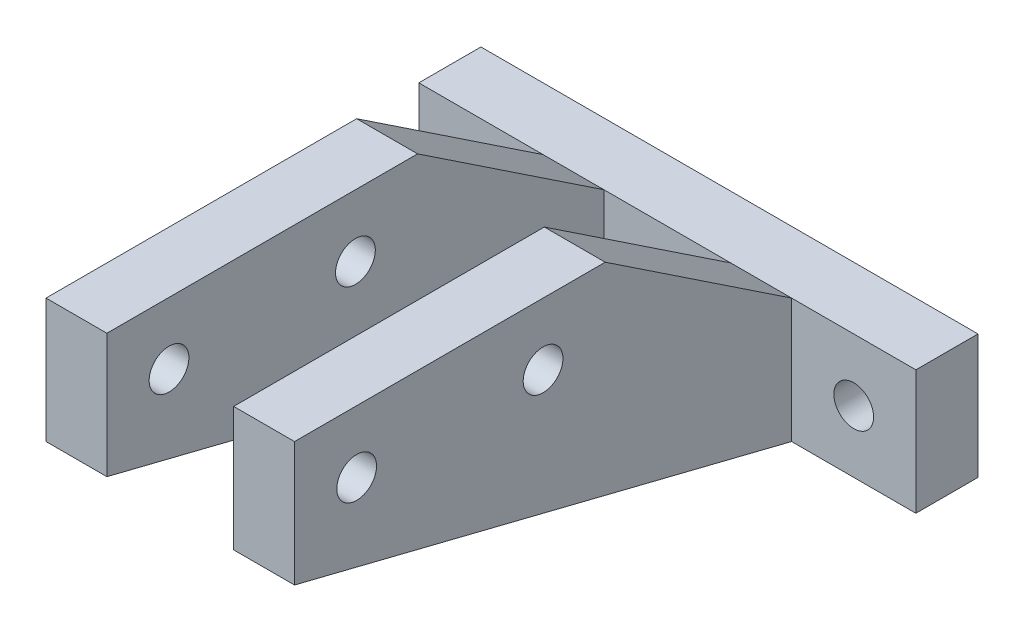
from build123d import *

# Parameters (mm, degrees)
SKETCH1_W           = 40
SKETCH1_H           = 10
BOSS_EXTRUDE1_DEPTH = 5
SKETCH2_W           = 4.9
SKETCH2_H           = 20
BOSS_EXTRUDE2_DEPTH = 40
CUT_EXTRUDE1_REACH  = 58.125
SKETCH3_R           = 1.6
CUT_EXTRUDE2_REACH  = 58.125
CUT_EXTRUDE3_REACH  = 58.125
CUT_EXTRUDE4_REACH  = 53.478
SKETCH6_R           = 1.6
SKETCH7_W           = 10.2
SKETCH7_H           = 3
BOSS_EXTRUDE3_DEPTH = 40
CUT_EXTRUDE5_DEPTH  = 40
SKETCH10_W          = 10.2
SKETCH10_H          = 2
BOSS_EXTRUDE4_DEPTH = 12


with BuildPart() as part:
    # Sketch1 → Boss-Extrude1 (new body)
    with BuildSketch(Plane.XY):
        Rectangle(SKETCH1_W, SKETCH1_H)
    extrude(amount=BOSS_EXTRUDE1_DEPTH)

    # Sketch2 → Boss-Extrude2 (add)
    with BuildSketch(Plane.XY.offset(5)):
        with Locations((7.55, 5)):
            Rectangle(SKETCH2_W, SKETCH2_H)
        with Locations((-7.55, 5)):
            Rectangle(SKETCH2_W, SKETCH2_H)
    extrude(amount=BOSS_EXTRUDE2_DEPTH)

    # Cut-Extrude1: up to this face of the body (flat: up to its plane)
    cut_extrude1_end = Plane(part.part.faces().sort_by_distance((10, 5, 25))[0])
    # Sketch3 → Cut-Extrude1 (cut, up to the picked face)
    with BuildSketch(Plane.ZY.offset(10), mode=Mode.PRIVATE) as cut_extrude1_sk1:
        with Locations((40, 10)):
            Circle(SKETCH3_R)
    cut_extrude1_tool1 = split(extrude(cut_extrude1_sk1.sketch, amount=-CUT_EXTRUDE1_REACH, mode=Mode.PRIVATE), bisect_by=cut_extrude1_end, keep=Keep.BOTH, mode=Mode.PRIVATE)
    # Sketch3 → Cut-Extrude1 (cut, up to the picked face)
    with BuildSketch(Plane.ZY.offset(10), mode=Mode.PRIVATE) as cut_extrude1_sk2:
        with Locations((25, 10)):
            Circle(SKETCH3_R)
    cut_extrude1_tool2 = split(extrude(cut_extrude1_sk2.sketch, amount=-CUT_EXTRUDE1_REACH, mode=Mode.PRIVATE), bisect_by=cut_extrude1_end, keep=Keep.BOTH, mode=Mode.PRIVATE)
    add(cut_extrude1_tool1.solids().sort_by(Axis((-10, 10, 40), (1, 0, 0)))[0], mode=Mode.SUBTRACT)
    add(cut_extrude1_tool2.solids().sort_by(Axis((-10, 10, 25), (1, 0, 0)))[0], mode=Mode.SUBTRACT)

    # Cut-Extrude2: up to this face of the body (flat: up to its plane)
    cut_extrude2_end = Plane(part.part.faces().sort_by_distance((10, 4.897406266, 24.846109398))[0])
    # Sketch4 → Cut-Extrude2 (cut, up to the picked face)
    with BuildSketch(Plane.ZY.offset(10), mode=Mode.PRIVATE) as cut_extrude2_sk1:
        Polygon((5, 5), (20, 15), (5, 15), align=None)
    cut_extrude2_tool1 = split(extrude(cut_extrude2_sk1.sketch, amount=-CUT_EXTRUDE2_REACH, mode=Mode.PRIVATE), bisect_by=cut_extrude2_end, keep=Keep.BOTH, mode=Mode.PRIVATE)
    add(cut_extrude2_tool1.solids().sort_by(Axis((-10, 11.666667, 10), (1, 0, 0)))[0], mode=Mode.SUBTRACT)

    # Cut-Extrude3: up to this face of the body (flat: up to its plane)
    cut_extrude3_end = Plane(part.part.faces().sort_by_distance((10, 4.181249184, 26.416760511))[0])
    # Sketch5 → Cut-Extrude3 (cut, up to the picked face)
    with BuildSketch(Plane.ZY.offset(10), mode=Mode.PRIVATE) as cut_extrude3_sk1:
        Polygon((45, 5), (5, -5), (45, -5), align=None)
    cut_extrude3_tool1 = split(extrude(cut_extrude3_sk1.sketch, amount=-CUT_EXTRUDE3_REACH, mode=Mode.PRIVATE), bisect_by=cut_extrude3_end, keep=Keep.BOTH, mode=Mode.PRIVATE)
    add(cut_extrude3_tool1.solids().sort_by(Axis((-10, -1.666667, 31.666667), (1, 0, 0)))[0], mode=Mode.SUBTRACT)

    # Sketch6 → Cut-Extrude4 (cut, up to next)
    with BuildSketch(Plane(origin=(0, 0, 0), x_dir=(-1, 0, 0), z_dir=(0, 0, -1)), mode=Mode.PRIVATE) as cut_extrude4_sk1:
        with Locations((-15, 0)):
            Circle(SKETCH6_R)
    cut_extrude4_tool1 = extrude(cut_extrude4_sk1.sketch, amount=-CUT_EXTRUDE4_REACH, mode=Mode.PRIVATE) & part.part
    # Sketch6 → Cut-Extrude4 (cut, up to next)
    with BuildSketch(Plane(origin=(0, 0, 0), x_dir=(-1, 0, 0), z_dir=(0, 0, -1)), mode=Mode.PRIVATE) as cut_extrude4_sk2:
        with Locations(Location((15, 0, 0), (0, 0, 180))):
            Circle(SKETCH6_R)
    cut_extrude4_tool2 = extrude(cut_extrude4_sk2.sketch, amount=-CUT_EXTRUDE4_REACH, mode=Mode.PRIVATE) & part.part
    add(cut_extrude4_tool1.solids().sort_by_distance((15, 0, 0))[0], mode=Mode.SUBTRACT)
    add(cut_extrude4_tool2.solids().sort_by_distance((-15, 0, 0))[0], mode=Mode.SUBTRACT)

    # Sketch7 → Boss-Extrude3 (add)
    with BuildSketch(Plane.XY.offset(5)):
        with Locations((0, -3.5)):
            Rectangle(SKETCH7_W, SKETCH7_H)
    extrude(amount=BOSS_EXTRUDE3_DEPTH)

    # Sketch8 → Cut-Extrude5 (cut)
    with BuildSketch(Plane.ZY.offset(5.1)):
        Polygon((5, -5), (25, 0), (45, 0), (45, -5), align=None)
    extrude(amount=-CUT_EXTRUDE5_DEPTH, mode=Mode.SUBTRACT)

    # Sketch10 → Boss-Extrude4 (add)
    with BuildSketch(Plane.XY.offset(5)):
        with Locations((0, -1)):
            Rectangle(SKETCH10_W, SKETCH10_H)
    extrude(amount=BOSS_EXTRUDE4_DEPTH)


solid = part.part
